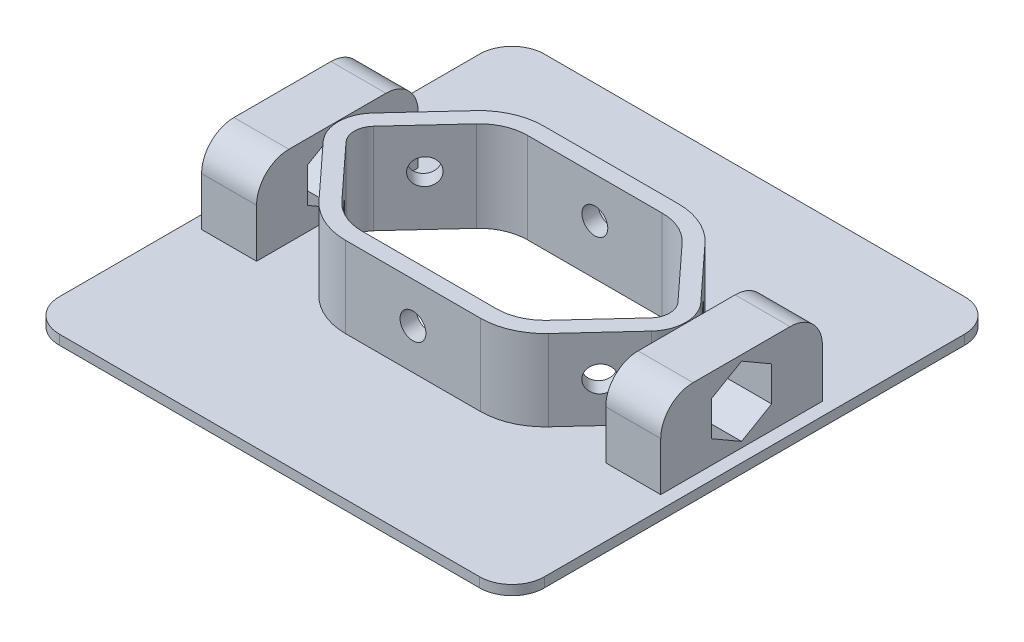
from build123d import *

# Parameters (mm, degrees)
SKETCH1_W           = 60
SKETCH1_H           = 60
BOSS_EXTRUDE1_DEPTH = 1.2
FILLET1_R           = 4
SKETCH3_W           = 6.8
SKETCH3_H           = 20
BOSS_EXTRUDE3_DEPTH = 10
FILLET2_R           = 4
CUT_EXTRUDE1_DEPTH  = 100
CUT_EXTRUDE2_DEPTH  = 44.588989435
BOSS_EXTRUDE4_START = 10
BOSS_EXTRUDE4_DEPTH = 10
CUT_EXTRUDE4_REACH  = 55.014
SKETCH6_R           = 1.6
CUT_EXTRUDE5_REACH  = 62.463
SKETCH7_R           = 1.6
CUT_EXTRUDE6_REACH  = 62.463
SKETCH8_R           = 1.6
CUT_EXTRUDE7_REACH  = 62.463
SKETCH9_R           = 1.6
CUT_EXTRUDE8_REACH  = 62.463
SKETCH10_R          = 1.6


with BuildPart() as part:
    # Sketch1 → Boss-Extrude1 (new body)
    with BuildSketch(Plane(origin=(0, 0, 0), x_dir=(1, 0, 0), z_dir=(0, 1, 0))):
        Rectangle(SKETCH1_W, SKETCH1_H)
    extrude(amount=BOSS_EXTRUDE1_DEPTH)

    # Fillet1
    fillet1_edges = [part.edges().sort_by_distance(p)[0] for p in [
        (30, 0.6, 30),
        (-30, 0.6, 30),
        (-30, 0.6, -30),
        (30, 0.6, -30),
    ]]
    fillet(fillet1_edges, radius=FILLET1_R)

    # Sketch3 → Boss-Extrude3 (add)
    with BuildSketch(Plane(origin=(0, 1.2, 0), x_dir=(1, 0, 0), z_dir=(0, 1, 0))):
        with Locations((-25, 0)):
            Rectangle(SKETCH3_W, SKETCH3_H)
        with Locations((25, 0)):
            Rectangle(SKETCH3_W, SKETCH3_H)
    extrude(amount=BOSS_EXTRUDE3_DEPTH)

    # Fillet2
    fillet2_edges = [part.edges().sort_by_distance(p)[0] for p in [
        (-25, 11.2, -10),
        (-25, 11.2, 10),
        (25, 11.2, 10),
        (25, 11.2, -10),
    ]]
    fillet(fillet2_edges, radius=FILLET2_R)

    # Sketch4 → Cut-Extrude1 (cut)
    with BuildSketch(Plane.ZY.offset(28.4)):
        Polygon((0, 1.9), (0, 10.5), (-3.723909236, 8.35), (-3.723909236, 4.05), align=None)
        Polygon((3.723909236, 8.35), (0, 10.5), (0, 1.9), (3.723909236, 4.05), align=None)
    extrude(amount=-CUT_EXTRUDE1_DEPTH, mode=Mode.SUBTRACT)

    # Sketch5 → Cut-Extrude2 (cut, through all)
    with BuildSketch(Plane(origin=(0, 1.2, 0), x_dir=(1, 0, 0), z_dir=(0, 1, 0))):
        with BuildLine():
            Line((18.838235294, 1.694370386), (12.734380374, 8.316488925))
            ThreePointArc((12.734380374, 8.316488925), (10.731045286, 9.74540415), (8.322615669, 10.25))
            Line((8.322615669, 10.25), (-8.322615669, 10.25))
            ThreePointArc((-8.322615669, 10.25), (-10.731045286, 9.74540415), (-12.734380374, 8.316488925))
            Line((-12.734380374, 8.316488925), (-18.838235294, 1.694370386))
            ThreePointArc((-18.838235294, 1.694370386), (-19.5, 0), (-18.838235294, -1.694370386))
            Line((-18.838235294, -1.694370386), (-12.734380374, -8.316488925))
            ThreePointArc((-12.734380374, -8.316488925), (-10.731045286, -9.74540415), (-8.322615669, -10.25))
            Line((-8.322615669, -10.25), (8.322615669, -10.25))
            ThreePointArc((8.322615669, -10.25), (10.731045286, -9.74540415), (12.734380374, -8.316488925))
            Line((12.734380374, -8.316488925), (18.838235294, -1.694370386))
            ThreePointArc((18.838235294, -1.694370386), (19.5, 0), (18.838235294, 1.694370386))
        make_face()
    extrude(amount=-CUT_EXTRUDE2_DEPTH, mode=Mode.SUBTRACT)

    # Sketch5<3> → Boss-Extrude4 (add)
    with BuildSketch(Plane(origin=(0, 1.2, 0), x_dir=(1, 0, 0), z_dir=(0, 1, 0)).offset(BOSS_EXTRUDE4_START)):
        with BuildLine():
            Line((20.308823529, 3.049866694), (14.20496861, 9.671985234))
            ThreePointArc((14.20496861, 9.671985234), (11.533855159, 11.577205534), (8.322615669, 12.25))
            Line((8.322615669, 12.25), (-8.322615669, 12.25))
            ThreePointArc((-8.322615669, 12.25), (-11.533855159, 11.577205534), (-14.20496861, 9.671985234))
            Line((-14.20496861, 9.671985234), (-20.308823529, 3.049866694))
            ThreePointArc((-20.308823529, 3.049866694), (-21.5, 0), (-20.308823529, -3.049866694))
            Line((-20.308823529, -3.049866694), (-14.20496861, -9.671985234))
            ThreePointArc((-14.20496861, -9.671985234), (-11.533855159, -11.577205534), (-8.322615669, -12.25))
            Line((-8.322615669, -12.25), (8.322615669, -12.25))
            ThreePointArc((8.322615669, -12.25), (11.533855159, -11.577205534), (14.20496861, -9.671985234))
            Line((14.20496861, -9.671985234), (20.308823529, -3.049866694))
            ThreePointArc((20.308823529, -3.049866694), (21.5, 0), (20.308823529, 3.049866694))
        make_face()
        with BuildLine():
            Line((18.838235294, 1.694370386), (12.734380374, 8.316488925))
            ThreePointArc((12.734380374, 8.316488925), (10.731045286, 9.74540415), (8.322615669, 10.25))
            Line((8.322615669, 10.25), (-8.322615669, 10.25))
            ThreePointArc((-8.322615669, 10.25), (-10.731045286, 9.74540415), (-12.734380374, 8.316488925))
            Line((-12.734380374, 8.316488925), (-18.838235294, 1.694370386))
            ThreePointArc((-18.838235294, 1.694370386), (-19.5, 0), (-18.838235294, -1.694370386))
            Line((-18.838235294, -1.694370386), (-12.734380374, -8.316488925))
            ThreePointArc((-12.734380374, -8.316488925), (-10.731045286, -9.74540415), (-8.322615669, -10.25))
            Line((-8.322615669, -10.25), (8.322615669, -10.25))
            ThreePointArc((8.322615669, -10.25), (10.731045286, -9.74540415), (12.734380374, -8.316488925))
            Line((12.734380374, -8.316488925), (18.838235294, -1.694370386))
            ThreePointArc((18.838235294, -1.694370386), (19.5, 0), (18.838235294, 1.694370386))
        make_face(mode=Mode.SUBTRACT)
    extrude(amount=-BOSS_EXTRUDE4_DEPTH)

    # Cut-Extrude4: up to this face of the body (flat: up to its plane)
    cut_extrude4_end = Plane(part.part.faces().sort_by_distance((0, 6.2, -12.25))[0])
    # Sketch6 → Cut-Extrude4 (cut, up to the picked face)
    with BuildSketch(Plane.XY.offset(12.25), mode=Mode.PRIVATE) as cut_extrude4_sk1:
        with Locations((0, 6.2)):
            Circle(SKETCH6_R)
    cut_extrude4_tool1 = split(extrude(cut_extrude4_sk1.sketch, amount=-CUT_EXTRUDE4_REACH, mode=Mode.PRIVATE), bisect_by=cut_extrude4_end, keep=Keep.BOTH, mode=Mode.PRIVATE)
    add(cut_extrude4_tool1.solids().sort_by(Axis((0, 6.2, 12.25), (0, 0, -1)))[0], mode=Mode.SUBTRACT)

    # Sketch7 → Cut-Extrude5 (cut, up to next)
    with BuildSketch(Plane(origin=(-12.5, 0, 11.521718622), x_dir=(0.677748154223703, 0, 0.7352941176470567), z_dir=(-0.7352941176470567, 0, 0.677748154223703)), mode=Mode.PRIVATE) as cut_extrude5_sk1:
        with Locations((-7.018678015, 6.2)):
            Circle(SKETCH7_R)
    cut_extrude5_tool1 = extrude(cut_extrude5_sk1.sketch, amount=-CUT_EXTRUDE5_REACH, mode=Mode.PRIVATE) & part.part
    add(cut_extrude5_tool1.solids().sort_by_distance((-17.256896, 6.2, 6.360926))[0], mode=Mode.SUBTRACT)

    # Sketch8 → Cut-Extrude6 (cut, up to next)
    with BuildSketch(Plane(origin=(12.5, 0, 11.521718622), x_dir=(0.6777481542236974, 0, -0.735294117647062), z_dir=(0.735294117647062, 0, 0.6777481542236974)), mode=Mode.PRIVATE) as cut_extrude6_sk1:
        with Locations((7.018678015, 6.2)):
            Circle(SKETCH8_R)
    cut_extrude6_tool1 = extrude(cut_extrude6_sk1.sketch, amount=-CUT_EXTRUDE6_REACH, mode=Mode.PRIVATE) & part.part
    add(cut_extrude6_tool1.solids().sort_by_distance((17.256896, 6.2, 6.360926))[0], mode=Mode.SUBTRACT)

    # Sketch9 → Cut-Extrude7 (cut, up to next)
    with BuildSketch(Plane(origin=(-12.5, 0, -11.521718622), x_dir=(-0.6777481542236947, 0, 0.7352941176470644), z_dir=(-0.7352941176470644, 0, -0.6777481542236947)), mode=Mode.PRIVATE) as cut_extrude7_sk1:
        with Locations((7.018678015, 6.2)):
            Circle(SKETCH9_R)
    cut_extrude7_tool1 = extrude(cut_extrude7_sk1.sketch, amount=-CUT_EXTRUDE7_REACH, mode=Mode.PRIVATE) & part.part
    add(cut_extrude7_tool1.solids().sort_by_distance((-17.256896, 6.2, -6.360926))[0], mode=Mode.SUBTRACT)

    # Sketch10 → Cut-Extrude8 (cut, up to next)
    with BuildSketch(Plane(origin=(12.5, 0, -11.521718622), x_dir=(-0.6777481542237005, 0, -0.7352941176470591), z_dir=(0.7352941176470591, 0, -0.6777481542237005)), mode=Mode.PRIVATE) as cut_extrude8_sk1:
        with Locations((-7.018678015, 6.2)):
            Circle(SKETCH10_R)
    cut_extrude8_tool1 = extrude(cut_extrude8_sk1.sketch, amount=-CUT_EXTRUDE8_REACH, mode=Mode.PRIVATE) & part.part
    add(cut_extrude8_tool1.solids().sort_by_distance((17.256896, 6.2, -6.360926))[0], mode=Mode.SUBTRACT)


solid = part.part
